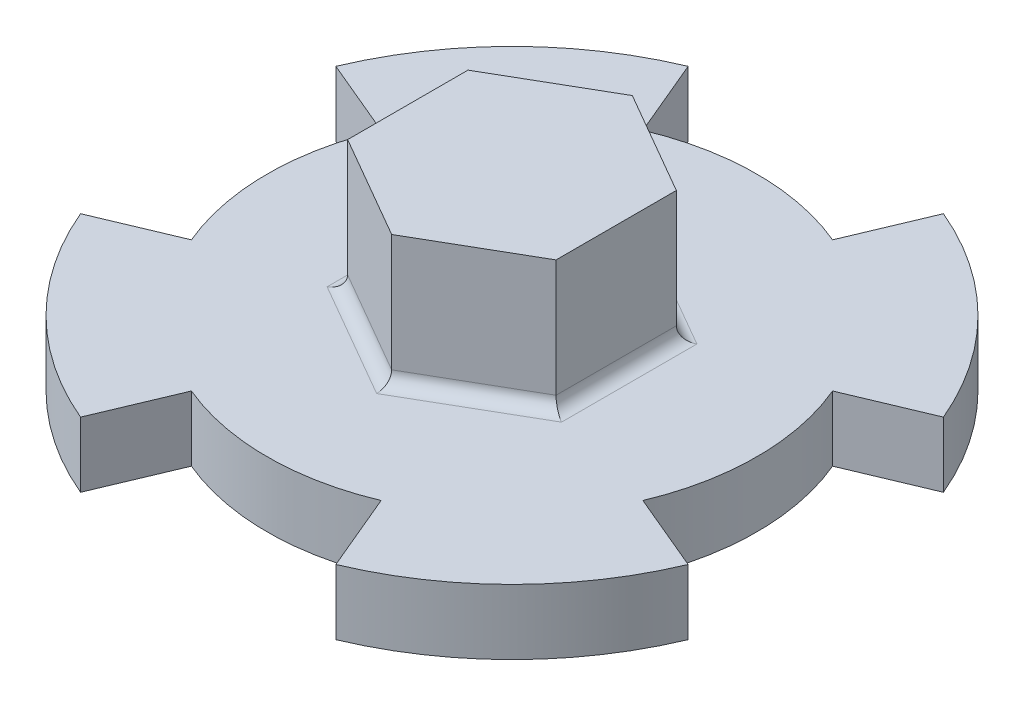
from build123d import *

# Parameters (mm, degrees)
BOSS_EXTRUDE1_DEPTH = 5
BOSS_EXTRUDE2_DEPTH = 10
FILLET3_R           = 1


with BuildPart() as part:
    # Sketch2 → Boss-Extrude1 (new body)
    with BuildSketch(Plane(origin=(0, 0, 0), x_dir=(1, 0, 0), z_dir=(0, 1, 0))):
        with BuildLine():
            Line((-23.324879421, 9.8), (-17.332321467, 7.282213439))
            ThreePointArc((-17.332321467, 7.282213439), (-18.8, 0), (-17.332321467, -7.282213439))
            Line((-17.332321467, -7.282213439), (-23.324879421, -9.8))
            ThreePointArc((-23.324879421, -9.8), (-17.889801564, -17.889801564), (-9.8, -23.324879421))
            Line((-9.8, -23.324879421), (-7.282213439, -17.332321467))
            ThreePointArc((-7.282213439, -17.332321467), (0, -18.8), (7.282213439, -17.332321467))
            Line((7.282213439, -17.332321467), (9.8, -23.324879421))
            ThreePointArc((9.8, -23.324879421), (17.889801564, -17.889801564), (23.324879421, -9.8))
            Line((23.324879421, -9.8), (17.332321467, -7.282213439))
            ThreePointArc((17.332321467, -7.282213439), (18.8, 0), (17.332321467, 7.282213439))
            Line((17.332321467, 7.282213439), (23.324879421, 9.8))
            ThreePointArc((23.324879421, 9.8), (17.889801564, 17.889801564), (9.8, 23.324879421))
            Line((9.8, 23.324879421), (7.282213439, 17.332321467))
            ThreePointArc((7.282213439, 17.332321467), (0, 18.8), (-7.282213439, 17.332321467))
            Line((-7.282213439, 17.332321467), (-9.8, 23.324879421))
            ThreePointArc((-9.8, 23.324879421), (-17.889801564, 17.889801564), (-23.324879421, 9.8))
        make_face()
    extrude(amount=BOSS_EXTRUDE1_DEPTH)

    # Sketch3 → Boss-Extrude2 (add)
    with BuildSketch(Plane(origin=(0, 5, 0), x_dir=(1, 0, 0), z_dir=(0, 1, 0))):
        Polygon((0, 9.237604307), (-8, 4.618802154), (-8, -4.618802154), (0, -9.237604307), (8, -4.618802154), (8, 4.618802154), align=None)
    extrude(amount=BOSS_EXTRUDE2_DEPTH)

    # Fillet3
    fillet3_edges = [part.edges().sort_by_distance(p)[0] for p in [
        (4, 5, -6.92820323),
        (-4, 5, -6.92820323),
        (-8, 5, 0),
        (-4, 5, 6.92820323),
        (4, 5, 6.92820323),
        (8, 5, 0),
    ]]
    fillet(fillet3_edges, radius=FILLET3_R)


solid = part.part
